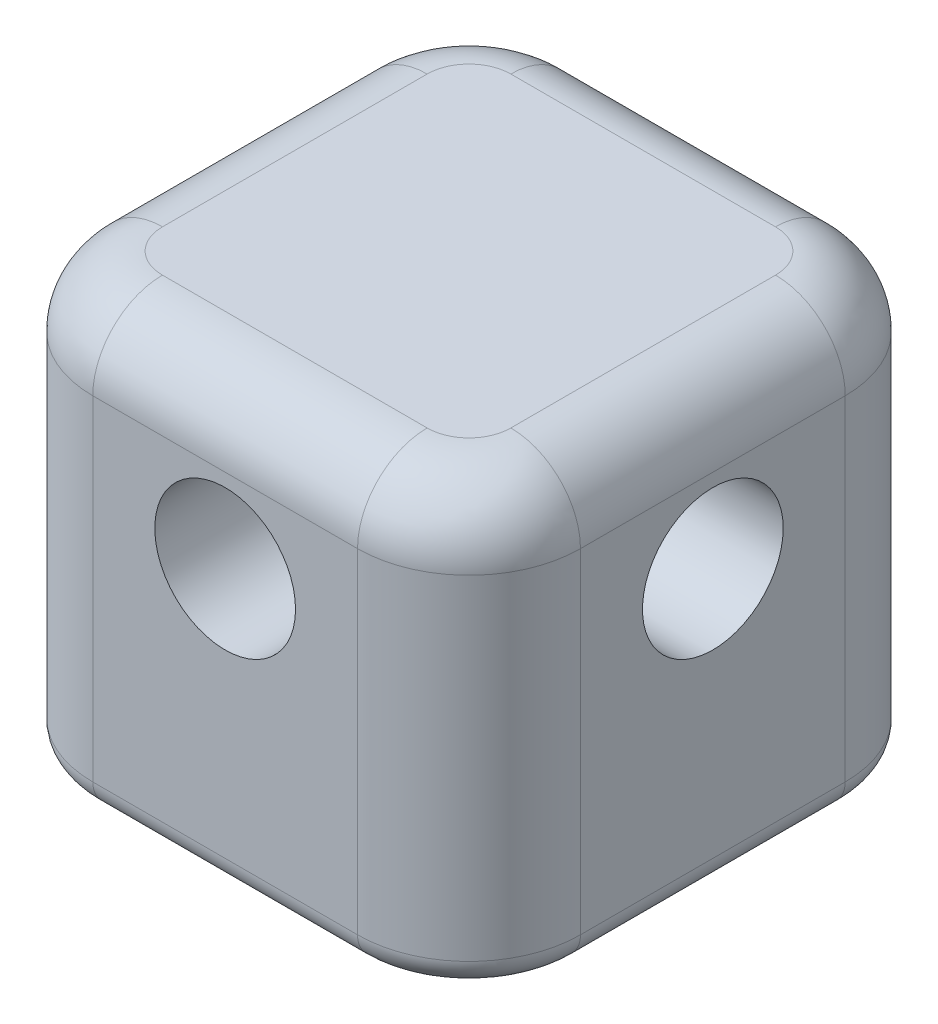
from build123d import *

# Parameters (mm, degrees)
SKETCH_1_R               = 18
EXTRUDE_1_DEPTH          = 40
CUT_EXTRUDE_2_DEPTH      = 88.891979156
CUT_EXTRUDE_2_DEPTH_BACK = 88.891979156
SKETCH_2_R               = 9
SKETCH_3_R               = 10.1
CUT_EXTRUDE_3_DEPTH      = 15
CUT_EXTRUDE_START        = -15
SKETCH_4_R               = 10.1
CUT_EXTRUDE_4_DEPTH      = 15
CUT_EXTRUDE_5_DEPTH      = 88.891979202
CUT_EXTRUDE_5_DEPTH_BACK = 88.891979202
SKETCH_5_R               = 9
SKETCH_6_R               = 10.1
CUT_EXTRUDE_6_DEPTH      = 15
CUT_EXTRUDE_START_2      = -8
SKETCH_7_R               = 10.1
CUT_EXTRUDE_7_DEPTH      = 8
EXTRUDE_2_DEPTH          = 2
FILLET_1_R               = 10
EXTRUDE_START            = 20
SKETCH_10_R              = 20.1
EXTRUDE_3_DEPTH          = 20
FILLET_2_R               = 4


with BuildPart() as part:
    # Эскиз1 → Бобышка-Вытянуть1 (new body)
    with BuildSketch(Plane(origin=(0, 0, 0), x_dir=(1, 0, 0), z_dir=(0, 1, 0))):
        with BuildLine():
            Line((19, 35), (-19, 35))
            ThreePointArc((-19, 35), (-30.313708499, 30.313708499), (-35, 19))
            Line((-35, 19), (-35, -19))
            ThreePointArc((-35, -19), (-30.313708499, -30.313708499), (-19, -35))
            Line((-19, -35), (19, -35))
            ThreePointArc((19, -35), (30.313708499, -30.313708499), (35, -19))
            Line((35, -19), (35, 19))
            ThreePointArc((35, 19), (30.313708499, 30.313708499), (19, 35))
        make_face()
        with Locations(Location((0, 0, 0), (0, 0, 270))):
            Circle(SKETCH_1_R, mode=Mode.SUBTRACT)
    extrude(amount=EXTRUDE_1_DEPTH)

    # Эскиз2 → Вырез-Вытянуть2 (cut, two sides: drawn at the far end of the back side and taken through both)
    with BuildSketch(Plane.ZY.offset(35).offset(-CUT_EXTRUDE_2_DEPTH_BACK)):
        with Locations((0, 20)):
            Circle(SKETCH_2_R)
    extrude(amount=CUT_EXTRUDE_2_DEPTH + CUT_EXTRUDE_2_DEPTH_BACK, mode=Mode.SUBTRACT)

    # Эскиз3 → Вырез-Вытянуть3 (cut)
    with BuildSketch(Plane.ZY.offset(35)):
        with Locations((0, 20)):
            Circle(SKETCH_3_R)
    extrude(amount=-CUT_EXTRUDE_3_DEPTH, mode=Mode.SUBTRACT)

    # Эскиз4 → Вырез-Вытянуть4 (cut)
    with BuildSketch(Plane(origin=(35, 0, 0), x_dir=(0, 0, -1), z_dir=(1, 0, 0)).offset(CUT_EXTRUDE_START)):
        with Locations(Location((0, 20, 0), (0, 0, 180))):
            Circle(SKETCH_4_R)
    extrude(amount=CUT_EXTRUDE_4_DEPTH, mode=Mode.SUBTRACT)

    # Эскиз5 → Вырез-Вытянуть5 (cut, two sides: drawn at the far end of the back side and taken through both)
    with BuildSketch(Plane.XY.offset(35).offset(-CUT_EXTRUDE_5_DEPTH_BACK)):
        with Locations((0, 20)):
            Circle(SKETCH_5_R)
    extrude(amount=CUT_EXTRUDE_5_DEPTH + CUT_EXTRUDE_5_DEPTH_BACK, mode=Mode.SUBTRACT)

    # Эскиз6 → Вырез-Вытянуть6 (cut)
    with BuildSketch(Plane.XY.offset(35)):
        with Locations((0, 20)):
            Circle(SKETCH_6_R)
    extrude(amount=-CUT_EXTRUDE_6_DEPTH, mode=Mode.SUBTRACT)

    # Эскиз7 → Вырез-Вытянуть7 (cut)
    with BuildSketch(Plane(origin=(0, 0, -35), x_dir=(-1, 0, 0), z_dir=(0, 0, -1)).offset(CUT_EXTRUDE_START_2)):
        with Locations(Location((0, 20, 0), (0, 0, 180))):
            Circle(SKETCH_7_R)
    extrude(amount=CUT_EXTRUDE_7_DEPTH, mode=Mode.SUBTRACT)

    # Эскиз9 → Бобышка-Вытянуть2 (add)
    with BuildSketch(Plane(origin=(0, 40, 0), x_dir=(1, 0, 0), z_dir=(0, 1, 0))):
        with BuildLine():
            Line((35, -19), (35, 19))
            ThreePointArc((35, 19), (30.313708499, 30.313708499), (19, 35))
            Line((19, 35), (-19, 35))
            ThreePointArc((-19, 35), (-30.313708499, 30.313708499), (-35, 19))
            Line((-35, 19), (-35, -19))
            ThreePointArc((-35, -19), (-30.313708499, -30.313708499), (-19, -35))
            Line((-19, -35), (19, -35))
            ThreePointArc((19, -35), (30.313708499, -30.313708499), (35, -19))
        make_face()
    extrude(amount=EXTRUDE_2_DEPTH)

    # Скругление1
    fillet_1_edges = [part.edges().sort_by_distance(p)[0] for p in [
        (30.313708499, 42, 30.313708499),
        (35, 42, 0),
        (30.313708499, 42, -30.313708499),
        (0, 42, -35),
        (-30.313708499, 42, -30.313708499),
        (-35, 42, 0),
        (-30.313708499, 42, 30.313708499),
        (0, 42, 35),
    ]]
    fillet(fillet_1_edges, radius=FILLET_1_R)

    # Эскиз10 → Бобышка-Вытянуть3 (add)
    with BuildSketch(Plane.XZ.offset(EXTRUDE_START)):
        with BuildLine():
            Line((19, 35), (-19, 35))
            ThreePointArc((-19, 35), (-30.313708499, 30.313708499), (-35, 19))
            Line((-35, 19), (-35, -19))
            ThreePointArc((-35, -19), (-30.313708499, -30.313708499), (-19, -35))
            Line((-19, -35), (19, -35))
            ThreePointArc((19, -35), (30.313708499, -30.313708499), (35, -19))
            Line((35, -19), (35, 19))
            ThreePointArc((35, 19), (30.313708499, 30.313708499), (19, 35))
        make_face()
        with Locations(Location((0, 0, 0), (0, 0, 270))):
            Circle(SKETCH_10_R, mode=Mode.SUBTRACT)
    extrude(amount=-EXTRUDE_3_DEPTH)

    # Скругление2
    fillet_2_edges = [part.edges().sort_by_distance(p)[0] for p in [
        (30.313708499, -20, 30.313708499),
        (0, -20, 35),
        (-30.313708499, -20, 30.313708499),
        (-35, -20, 0),
        (-30.313708499, -20, -30.313708499),
        (0, -20, -35),
        (30.313708499, -20, -30.313708499),
        (35, -20, 0),
    ]]
    fillet(fillet_2_edges, radius=FILLET_2_R)


solid = part.part
